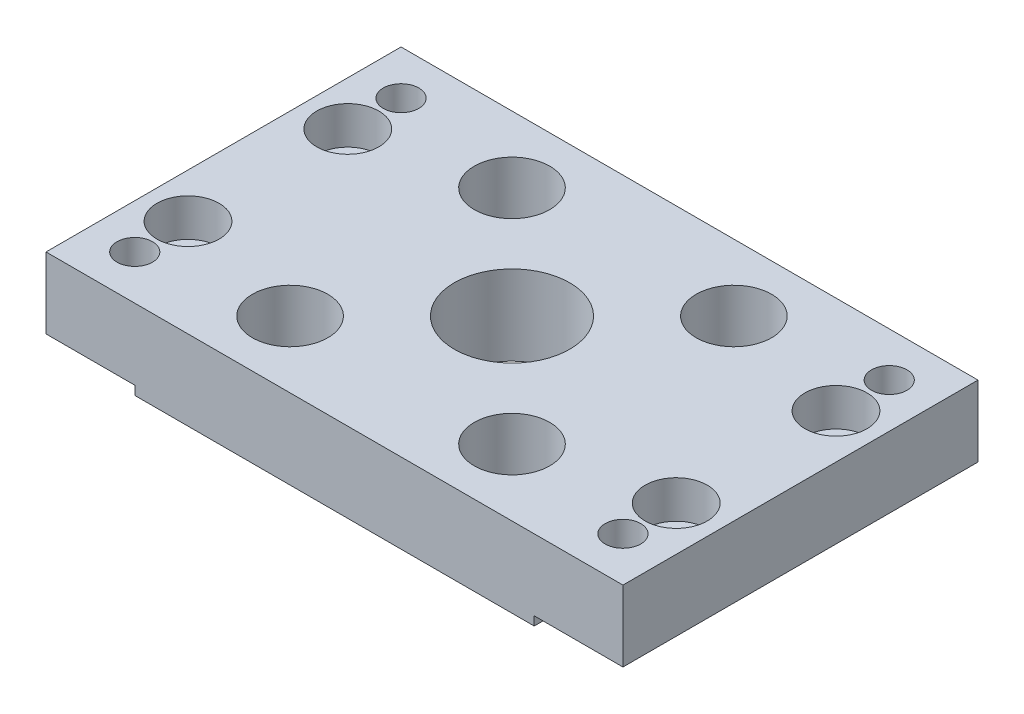
from build123d import *

# Parameters (mm, degrees)
SALIENTE_EXTRUIR1_DEPTH = 80
CROQUIS2_R              = 13
CROQUIS2_R_2            = 4
CROQUIS2_R_3            = 4.5
CORTAR_EXTRUIR1_DEPTH   = 105.637469388
CROQUIS4_R              = 7
CORTAR_EXTRUIR2_DEPTH   = 8.5
CORTAR_EXTRUIR3_REACH   = 106.637
CROQUIS5_R              = 5.5
CROQUIS6_R              = 8.5
CORTAR_EXTRUIR4_DEPTH   = 13
CROQUIS7_R              = 3
CORTAR_EXTRUIR5_DEPTH   = 30


with BuildPart() as part:
    # Croquis1 → Saliente-Extruir1 (new body)
    with BuildSketch(Plane.XY):
        Polygon((65, 0), (-65, 0), (-65, -16), (-45, -16), (-45, -18), (45, -18), (45, -16), (65, -16), align=None)
    extrude(amount=-SALIENTE_EXTRUIR1_DEPTH)

    # Croquis2 → Cortar-Extruir1 (cut, through all)
    with BuildSketch(Plane(origin=(0, 0, 0), x_dir=(1, 0, 0), z_dir=(0, 1, 0))):
        with Locations(Location((0, 40, 0), (0, 0, 180))):
            Circle(CROQUIS2_R)
        with Locations(Location((-55, 70, 0), (0, 0, 180))):
            Circle(CROQUIS2_R_2)
        with Locations(Location((-55, 10, 0), (0, 0, 180))):
            Circle(CROQUIS2_R_2)
        with Locations(Location((55, 10, 0), (0, 0, 180))):
            Circle(CROQUIS2_R_2)
        with Locations(Location((55, 70, 0), (0, 0, 180))):
            Circle(CROQUIS2_R_2)
        with Locations(Location((-55, 58, 0), (0, 0, 180))):
            Circle(CROQUIS2_R_3)
        with Locations(Location((-55, 22, 0), (0, 0, 180))):
            Circle(CROQUIS2_R_3)
        with Locations(Location((55, 58, 0), (0, 0, 180))):
            Circle(CROQUIS2_R_3)
        with Locations(Location((55, 22, 0), (0, 0, 180))):
            Circle(CROQUIS2_R_3)
    extrude(amount=-CORTAR_EXTRUIR1_DEPTH, mode=Mode.SUBTRACT)

    # Croquis4 → Cortar-Extruir2 (cut)
    with BuildSketch(Plane(origin=(0, 0, 0), x_dir=(1, 0, 0), z_dir=(0, 1, 0))):
        with Locations(Location((-55, 58, 0), (0, 0, 180))):
            Circle(CROQUIS4_R)
        with Locations(Location((-55, 22, 0), (0, 0, 180))):
            Circle(CROQUIS4_R)
        with Locations(Location((55, 58, 0), (0, 0, 180))):
            Circle(CROQUIS4_R)
        with Locations(Location((55, 22, 0), (0, 0, 180))):
            Circle(CROQUIS4_R)
    extrude(amount=-CORTAR_EXTRUIR2_DEPTH, mode=Mode.SUBTRACT)

    # Croquis5 → Cortar-Extruir3 (cut, up to next)
    with BuildSketch(Plane(origin=(0, 0, 0), x_dir=(1, 0, 0), z_dir=(0, 1, 0)), mode=Mode.PRIVATE) as cortar_extruir3_sk1:
        with Locations(Location((-25, 65, 0), (0, 0, 180))):
            Circle(CROQUIS5_R)
    cortar_extruir3_tool1 = extrude(cortar_extruir3_sk1.sketch, amount=-CORTAR_EXTRUIR3_REACH, mode=Mode.PRIVATE) & part.part
    # Croquis5 → Cortar-Extruir3 (cut, up to next)
    with BuildSketch(Plane(origin=(0, 0, 0), x_dir=(1, 0, 0), z_dir=(0, 1, 0)), mode=Mode.PRIVATE) as cortar_extruir3_sk2:
        with Locations(Location((-25, 15, 0), (0, 0, 180))):
            Circle(CROQUIS5_R)
    cortar_extruir3_tool2 = extrude(cortar_extruir3_sk2.sketch, amount=-CORTAR_EXTRUIR3_REACH, mode=Mode.PRIVATE) & part.part
    # Croquis5 → Cortar-Extruir3 (cut, up to next)
    with BuildSketch(Plane(origin=(0, 0, 0), x_dir=(1, 0, 0), z_dir=(0, 1, 0)), mode=Mode.PRIVATE) as cortar_extruir3_sk3:
        with Locations(Location((25, 15, 0), (0, 0, 180))):
            Circle(CROQUIS5_R)
    cortar_extruir3_tool3 = extrude(cortar_extruir3_sk3.sketch, amount=-CORTAR_EXTRUIR3_REACH, mode=Mode.PRIVATE) & part.part
    # Croquis5 → Cortar-Extruir3 (cut, up to next)
    with BuildSketch(Plane(origin=(0, 0, 0), x_dir=(1, 0, 0), z_dir=(0, 1, 0)), mode=Mode.PRIVATE) as cortar_extruir3_sk4:
        with Locations(Location((25, 65, 0), (0, 0, 180))):
            Circle(CROQUIS5_R)
    cortar_extruir3_tool4 = extrude(cortar_extruir3_sk4.sketch, amount=-CORTAR_EXTRUIR3_REACH, mode=Mode.PRIVATE) & part.part
    add(cortar_extruir3_tool1.solids().sort_by_distance((-25, 0, -65))[0], mode=Mode.SUBTRACT)
    add(cortar_extruir3_tool2.solids().sort_by_distance((-25, 0, -15))[0], mode=Mode.SUBTRACT)
    add(cortar_extruir3_tool3.solids().sort_by_distance((25, 0, -15))[0], mode=Mode.SUBTRACT)
    add(cortar_extruir3_tool4.solids().sort_by_distance((25, 0, -65))[0], mode=Mode.SUBTRACT)

    # Croquis6 → Cortar-Extruir4 (cut)
    with BuildSketch(Plane(origin=(0, 0, 0), x_dir=(1, 0, 0), z_dir=(0, 1, 0))):
        with Locations(Location((-25, 65, 0), (0, 0, 180))):
            Circle(CROQUIS6_R)
        with Locations(Location((-25, 15, 0), (0, 0, 180))):
            Circle(CROQUIS6_R)
        with Locations(Location((25, 15, 0), (0, 0, 180))):
            Circle(CROQUIS6_R)
        with Locations(Location((25, 65, 0), (0, 0, 180))):
            Circle(CROQUIS6_R)
    extrude(amount=-CORTAR_EXTRUIR4_DEPTH, mode=Mode.SUBTRACT)

    # Croquis7 → Cortar-Extruir5 (cut)
    with BuildSketch(Plane(origin=(0, 0, -80), x_dir=(-1, 0, 0), z_dir=(0, 0, -1))):
        with Locations((38, -8)):
            Circle(CROQUIS7_R)
        with Locations((-38, -8)):
            Circle(CROQUIS7_R)
    extrude(amount=-CORTAR_EXTRUIR5_DEPTH, mode=Mode.SUBTRACT)


solid = part.part
